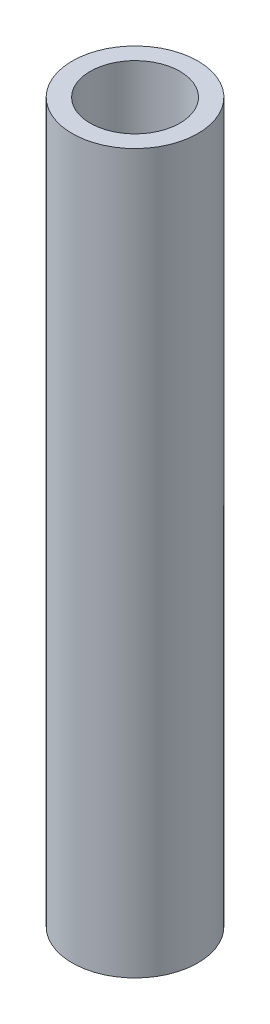
from build123d import *

# Parameters (mm, degrees)
SKETCH1_R           = 13.335
SKETCH1_R_2         = 9.525
BOSS_EXTRUDE1_DEPTH = 152.4


with BuildPart() as part:
    # Sketch1 → Boss-Extrude1 (new body)
    with BuildSketch(Plane(origin=(0, 0, 0), x_dir=(1, 0, 0), z_dir=(0, 1, 0))):
        with Locations(Location((0, 0, 0), (0, 0, 90))):
            Circle(SKETCH1_R)
        with Locations(Location((0, 0, 0), (0, 0, 90))):
            Circle(SKETCH1_R_2, mode=Mode.SUBTRACT)
    extrude(amount=BOSS_EXTRUDE1_DEPTH)


solid = part.part
